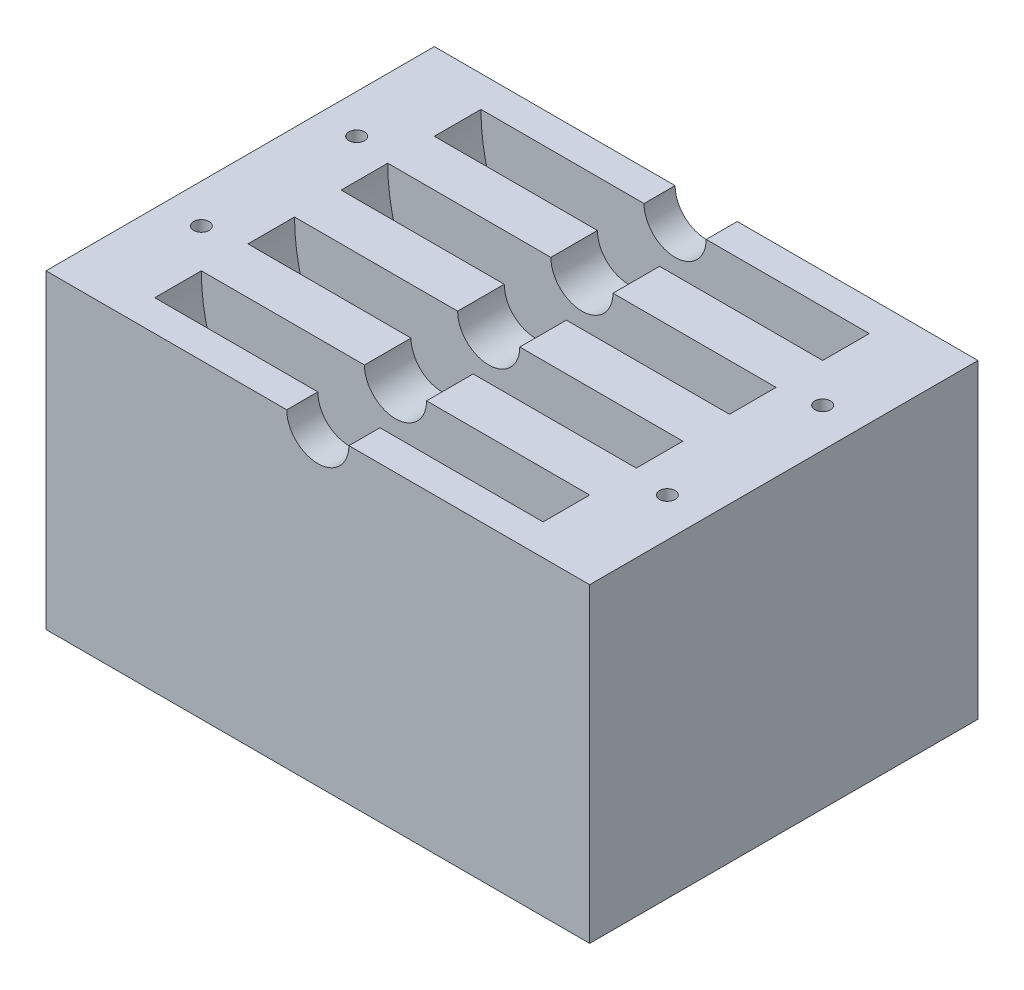
from build123d import *

# Parameters (mm, degrees)
BOSS_EXTRUDE1_DEPTH   = 105
BOSS_EXTRUDE1_2_DEPTH = 105
BOSS_EXTRUDE6_DEPTH   = 15
BOSS_EXTRUDE9_START   = -30
BOSS_EXTRUDE9_DEPTH   = 30
BOSS_EXTRUDE10_DEPTH  = 30
SKETCH7_W             = 350
SKETCH7_H             = 200
BOSS_EXTRUDE11_DEPTH  = 20
SKETCH8_W             = 350
SKETCH8_H             = 200
BOSS_EXTRUDE12_DEPTH  = 20
SKETCH9_R             = 20
CUT_EXTRUDE1_DEPTH    = 300
SKETCH10_R            = 5
CUT_EXTRUDE2_DEPTH    = 20


with BuildPart() as part:
    # Sketch1 → Boss-Extrude1 (new, symmetric)
    with BuildSketch(Plane.XY):
        with BuildLine():
            Line((125, -35.707142143), (125, -54.024352148))
            ThreePointArc((125, -54.024352148), (118.230654865, -67.565841039), (110, -80.27222823))
            Line((110, -80.27222823), (110, -200))
            Line((110, -200), (125, -200))
            Line((125, -200), (175, -200))
            Line((175, -200), (175, 0))
            Line((175, 0), (125, 0))
            ThreePointArc((125, 0), (121.191996435, -30.618621785), (110, -59.371710435))
            Line((110, -59.371710435), (110, -69.282032303))
            ThreePointArc((110, -69.282032303), (118.693168769, -53.027650218), (125, -35.707142143))
        make_face()
    extrude(amount=BOSS_EXTRUDE1_DEPTH, both=True)



with BuildPart() as body_2:
    # Sketch1 → Boss-Extrude1 2 (new, symmetric)
    with BuildSketch(Plane.XY):
        with BuildLine():
            Line((-110, -200), (-125, -200))
            Line((-125, -200), (-175, -200))
            Line((-175, -200), (-175, 0))
            Line((-175, 0), (-125, 0))
            ThreePointArc((-125, 0), (-121.191996435, -30.618621785), (-110, -59.371710435))
            Line((-110, -59.371710435), (-110, -69.282032303))
            ThreePointArc((-110, -69.282032303), (-118.693168769, -53.027650218), (-125, -35.707142143))
            Line((-125, -35.707142143), (-125, -54.024352148))
            ThreePointArc((-125, -54.024352148), (-118.230654865, -67.565841039), (-110, -80.27222823))
            Line((-110, -80.27222823), (-110, -200))
        make_face()
    extrude(amount=BOSS_EXTRUDE1_2_DEPTH, both=True)


with BuildPart() as part_1:
    add(part.part)

    add(body_2.part)  # Boss-Extrude6 merges body 2
    # Sketch6 → Boss-Extrude6 (add, symmetric)
    with BuildSketch(Plane.XY):
        with BuildLine():
            Line((-110, -69.282032303), (-110, -59.371710435))
            ThreePointArc((-110, -59.371710435), (-121.191996435, -30.618621785), (-125, 0))
            Line((-125, 0), (125, 0))
            ThreePointArc((125, 0), (121.191996435, -30.618621785), (110, -59.371710435))
            Line((110, -59.371710435), (110, -69.282032303))
            Line((110, -69.282032303), (-110, -69.282032303))
        make_face()
    extrude(amount=BOSS_EXTRUDE6_DEPTH, both=True)

    # 3DSketch3 → Boss-Extrude9 (add)
    with BuildSketch(Plane(origin=(-110, -59.371710435, 45), x_dir=(0.9695359714832644, 0.2449489742783234, 0), z_dir=(0, 0, -1)).offset(BOSS_EXTRUDE9_START)):
        with BuildLine():
            Line((0, 0), (-2.427523176, 9.60841354))
            Line((-2.427523176, 9.60841354), (210.87039055, 63.497187881))
            Line((210.87039055, 63.497187881), (213.297913726, 53.888774341))
            ThreePointArc((213.297913726, 53.888774341), (231.191996435, 28.75308865), (242.383992871, 0))
            Line((242.383992871, 0), (0, -61.23724357))
            ThreePointArc((0, -61.23724357), (-3.808003565, -30.618621785), (0, 0))
        make_face()
    extrude(amount=BOSS_EXTRUDE9_DEPTH)

    # 3DSketch4 → Boss-Extrude10 (add)
    with BuildSketch(Plane(origin=(110, -59.371710435, -45), x_dir=(-0.9695359714832668, 0.2449489742783143, 0), z_dir=(0, 0, 1))):
        with BuildLine():
            Line((0, 0), (-2.427523176, 9.60841354))
            Line((-2.427523176, 9.60841354), (210.87039055, 63.497187881))
            Line((210.87039055, 63.497187881), (213.297913726, 53.888774341))
            ThreePointArc((213.297913726, 53.888774341), (231.191996435, 28.75308865), (242.383992871, 0))
            Line((242.383992871, 0), (0, -61.23724357))
            ThreePointArc((0, -61.23724357), (-3.808003565, -30.618621785), (0, 0))
        make_face()
    extrude(amount=-BOSS_EXTRUDE10_DEPTH)

    # Sketch7 → Boss-Extrude11 (add)
    with BuildSketch(Plane.XY.offset(105)):
        with Locations((0, -100)):
            Rectangle(SKETCH7_W, SKETCH7_H)
    extrude(amount=BOSS_EXTRUDE11_DEPTH)

    # Sketch8 → Boss-Extrude12 (add)
    with BuildSketch(Plane(origin=(0, 0, -105), x_dir=(-1, 0, 0), z_dir=(0, 0, -1))):
        with Locations((0, -100)):
            Rectangle(SKETCH8_W, SKETCH8_H)
    extrude(amount=BOSS_EXTRUDE12_DEPTH)

    # Sketch9 → Cut-Extrude1 (cut)
    with BuildSketch(Plane.XY.offset(125)):
        Circle(SKETCH9_R)
    extrude(amount=-CUT_EXTRUDE1_DEPTH, mode=Mode.SUBTRACT)

    # Sketch10 → Cut-Extrude2 (cut)
    with BuildSketch(Plane(origin=(0, 0, 0), x_dir=(1, 0, 0), z_dir=(0, 1, 0))):
        with Locations(Location((150, 50, 0), (0, 0, 270))):
            Circle(SKETCH10_R)
        with Locations(Location((150, -50, 0), (0, 0, 90))):
            Circle(SKETCH10_R)
        with Locations(Location((-150, -50, 0), (0, 0, 270))):
            Circle(SKETCH10_R)
        with Locations(Location((-150, 50, 0), (0, 0, 90))):
            Circle(SKETCH10_R)
    extrude(amount=-CUT_EXTRUDE2_DEPTH, mode=Mode.SUBTRACT)


solid = part_1.part
